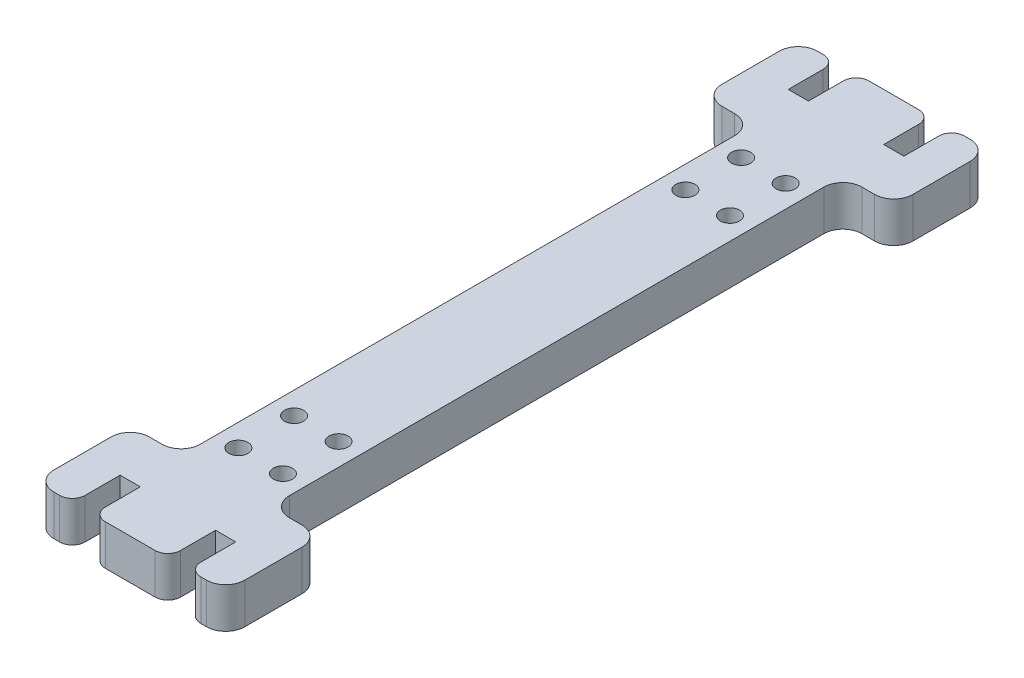
from build123d import *

# Parameters (mm, degrees)
BOSS_EXTRUDE1_DEPTH = 6.35
SKETCH2_W           = 3.175
SKETCH2_H           = 15
CUT_EXTRUDE1_DEPTH  = 63.171717847
SKETCH5_R           = 1.5
CUT_EXTRUDE2_DEPTH  = 10
FILLET1_R           = 2
FILLET2_R           = 3


with BuildPart() as part:
    # Sketch1 → Boss-Extrude1 (new body)
    with BuildSketch(Plane(origin=(0, 0, 0), x_dir=(1, 0, 0), z_dir=(0, 1, 0))):
        Polygon((-15, 60), (15, 60), (15, 45), (7, 45), (7, -45), (15, -45), (15, -60), (-15, -60), (-15, -45), (-7, -45), (-7, 45), (-15, 45), align=None)
    extrude(amount=BOSS_EXTRUDE1_DEPTH)

    # Sketch2 → Cut-Extrude1 (cut, through all)
    with BuildSketch(Plane(origin=(0, 6.35, 0), x_dir=(1, 0, 0), z_dir=(0, 1, 0))):
        with Locations((7.5, 60)):
            Rectangle(SKETCH2_W, SKETCH2_H)
        with Locations((-7.5, 60)):
            Rectangle(SKETCH2_W, SKETCH2_H)
        with Locations((7.5, -60)):
            Rectangle(SKETCH2_W, SKETCH2_H)
        with Locations((-7.5, -60)):
            Rectangle(SKETCH2_W, SKETCH2_H)
    extrude(amount=-CUT_EXTRUDE1_DEPTH, mode=Mode.SUBTRACT)

    # Sketch5 → Cut-Extrude2 (cut)
    with BuildSketch(Plane.XZ):
        with Locations(Location((3.5, -39.5, 0), (0, 0, 270))):
            Circle(SKETCH5_R)
        with Locations(Location((-3.5, -39.5, 0), (0, 0, 270))):
            Circle(SKETCH5_R)
        with Locations(Location((-3.5, -30.75, 0), (0, 0, 270))):
            Circle(SKETCH5_R)
        with Locations(Location((3.5, 30.75, 0), (0, 0, 270))):
            Circle(SKETCH5_R)
        with Locations(Location((-3.5, 30.75, 0), (0, 0, 270))):
            Circle(SKETCH5_R)
        with Locations(Location((3.5, 39.5, 0), (0, 0, 270))):
            Circle(SKETCH5_R)
        with Locations(Location((-3.5, 39.5, 0), (0, 0, 270))):
            Circle(SKETCH5_R)
        with Locations(Location((3.5, -30.75, 0), (0, 0, 270))):
            Circle(SKETCH5_R)
    extrude(amount=-CUT_EXTRUDE2_DEPTH, mode=Mode.SUBTRACT)

    # Fillet1
    fillet1_edges = [part.edges().sort_by_distance(p)[0] for p in [
        (-5.9125, 3.175, -60),
        (-9.0875, 3.175, -60),
        (5.9125, 3.175, 60),
        (9.0875, 3.175, 60),
        (-5.9125, 3.175, 60),
        (-9.0875, 3.175, 60),
        (9.0875, 3.175, -60),
        (5.9125, 3.175, -60),
    ]]
    fillet(fillet1_edges, radius=FILLET1_R)

    # Fillet2
    fillet2_edges = [part.edges().sort_by_distance(p)[0] for p in [
        (7, 3.175, -45),
        (7, 3.175, 45),
        (15, 3.175, 45),
        (15, 3.175, 60),
        (-15, 3.175, 60),
        (-15, 3.175, 45),
        (-7, 3.175, 45),
        (-7, 3.175, -45),
        (-15, 3.175, -45),
        (-15, 3.175, -60),
        (15, 3.175, -60),
        (15, 3.175, -45),
    ]]
    fillet(fillet2_edges, radius=FILLET2_R)


solid = part.part
